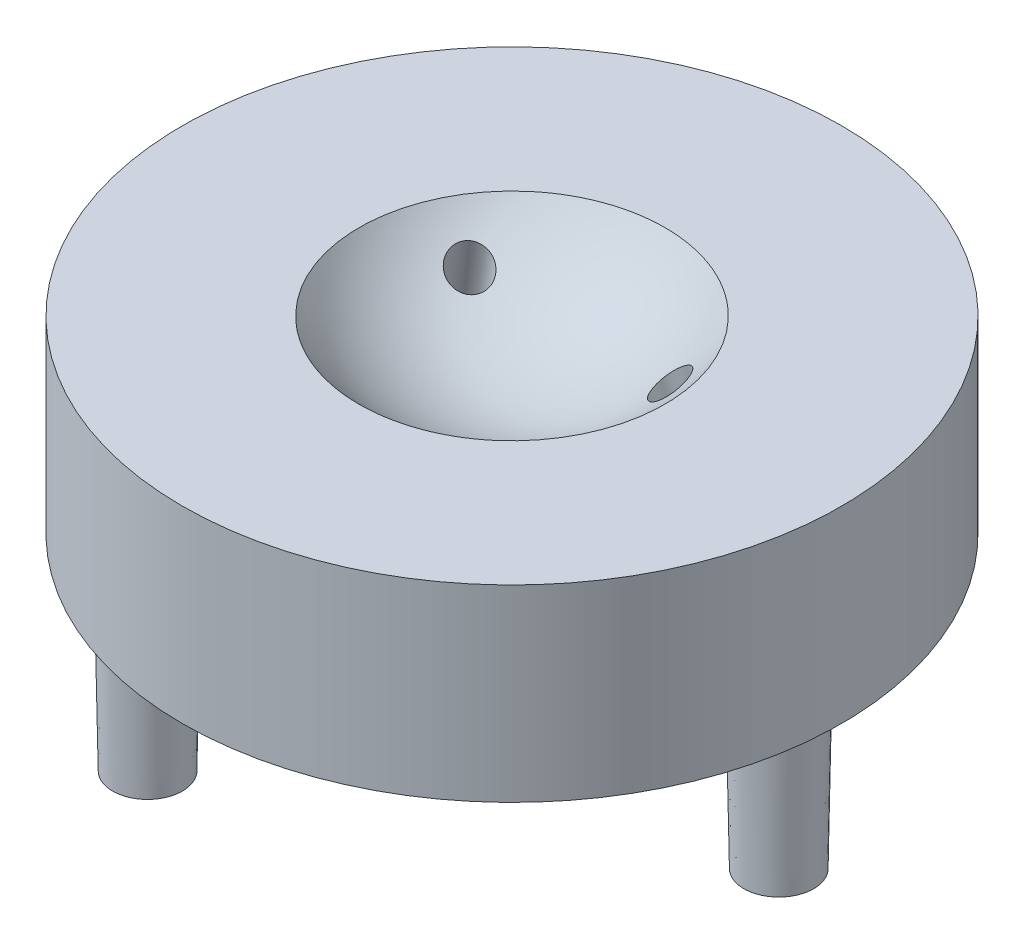
from build123d import *

# Parameters (mm, degrees)
EXTRUDE_1_DEPTH           = 6
SKETCH_6_OUTSIDE_W        = 112.61
SKETCH_6_OUTSIDE_H        = 112.61
SKETCH_6_OUTSIDE_R        = 10.5
CUT_EXTRUDE_2_DEPTH       = 10
SKETCH_7_R                = 1.2
EXTRUDE_3_DEPTH           = 5
EXTRUDE_3_DRAFT           = 1
EXTRUDE_3_PROFILE_2_DEPTH = 5
EXTRUDE_3_PROFILE_2_DRAFT = 1
EXTRUDE_3_PROFILE_3_DEPTH = 5
EXTRUDE_3_PROFILE_3_DRAFT = 1
SWEEP_1_PROFILE_R         = 0.6
PATTERN_CIRCULAR_1_COUNT  = 3


with BuildPart() as part:
    # 草图1 → 凸台-拉伸1 (new body)
    with BuildSketch(Plane(origin=(0, 0, 0), x_dir=(1, 0, 0), z_dir=(0, 1, 0))):
        with BuildLine():
            Line((-28.1, 43.1), (28.1, 43.1))
            ThreePointArc((28.1, 43.1), (38.706601718, 38.706601718), (43.1, 28.1))
            Line((43.1, 28.1), (43.1, -28.1))
            ThreePointArc((43.1, -28.1), (38.706601718, -38.706601718), (28.1, -43.1))
            Line((28.1, -43.1), (-28.1, -43.1))
            ThreePointArc((-28.1, -43.1), (-38.706601718, -38.706601718), (-43.1, -28.1))
            Line((-43.1, -28.1), (-43.1, 28.1))
            ThreePointArc((-43.1, 28.1), (-38.706601718, 38.706601718), (-28.1, 43.1))
        make_face()
    extrude(amount=EXTRUDE_1_DEPTH)

    # 草图6 outside → 切除-拉伸2 (cut)
    with BuildSketch(Plane(origin=(0, 6, 0), x_dir=(1, 0, 0), z_dir=(0, 1, 0))):
        Rectangle(SKETCH_6_OUTSIDE_W, SKETCH_6_OUTSIDE_H)
        with Locations(Location((0, 0, 0), (0, 0, 270))):
            Circle(SKETCH_6_OUTSIDE_R, mode=Mode.SUBTRACT)
    extrude(amount=-CUT_EXTRUDE_2_DEPTH, mode=Mode.SUBTRACT)


with BuildPart() as extrude_3_tool:
    # 草图7 → 凸台-拉伸3 (with draft: the straight prism first)
    with BuildSketch(Plane.XZ):
        with Locations((8.5, 0)):
            Circle(SKETCH_7_R)
    extrude(amount=EXTRUDE_3_DEPTH)
    # 凸台-拉伸3: the draft: its side faces are tilted about the plane it starts from
    extrude_3_sides = [extrude_3_tool.faces().sort_by_distance(p)[0] for p in [
        (7.3, -2.5, 0),
    ]]
    draft(extrude_3_sides, Plane.XZ, EXTRUDE_3_DRAFT)


with BuildPart() as part_1:
    add(part.part)

    # 凸台-拉伸3: add extrude_3_tool
    add(extrude_3_tool.part)


with BuildPart() as extrude_3_profile_2_tool:
    # 草图7 → 凸台-拉伸3 profile 2 (with draft: the straight prism first)
    with BuildSketch(Plane.XZ):
        with Locations((-4.25, -7.361215932)):
            Circle(SKETCH_7_R)
    extrude(amount=EXTRUDE_3_PROFILE_2_DEPTH)
    # 凸台-拉伸3 profile 2: the draft: its side faces are tilted about the plane it starts from
    extrude_3_profile_2_sides = [extrude_3_profile_2_tool.faces().sort_by_distance(p)[0] for p in [
        (-5.45, -2.5, -7.361215932),
    ]]
    draft(extrude_3_profile_2_sides, Plane.XZ, EXTRUDE_3_PROFILE_2_DRAFT)


with BuildPart() as part_2:
    add(part_1.part)

    # 凸台-拉伸3 profile 2: add extrude_3_profile_2_tool
    add(extrude_3_profile_2_tool.part)


with BuildPart() as extrude_3_profile_3_tool:
    # 草图7 → 凸台-拉伸3 profile 3 (with draft: the straight prism first)
    with BuildSketch(Plane.XZ):
        with Locations((-4.25, 7.361215932)):
            Circle(SKETCH_7_R)
    extrude(amount=EXTRUDE_3_PROFILE_3_DEPTH)
    # 凸台-拉伸3 profile 3: the draft: its side faces are tilted about the plane it starts from
    extrude_3_profile_3_sides = [extrude_3_profile_3_tool.faces().sort_by_distance(p)[0] for p in [
        (-5.45, -2.5, 7.361215932),
    ]]
    draft(extrude_3_profile_3_sides, Plane.XZ, EXTRUDE_3_PROFILE_3_DRAFT)


with BuildPart() as part_3:
    add(part_2.part)

    # 凸台-拉伸3 profile 3: add extrude_3_profile_3_tool
    add(extrude_3_profile_3_tool.part)

    # 草图8 → 切除-旋转1 (revolve, cut)
    with BuildSketch(Plane(origin=(0, 9.5, 0), x_dir=(1, 0, 0), z_dir=(0, 1, 0))):
        with BuildLine():
            Line((0, 6), (0, -6))
            ThreePointArc((0, -6), (-6, 0), (0, 6))
        make_face()
    revolve(axis=Axis((0, 9.5, -6), (0, 0, 1)), mode=Mode.SUBTRACT)

    # 切除-拉伸3 cone 1 section (through the dimple's axis) → 切除-拉伸3 (revolve, cut)
    with BuildSketch(Plane(origin=(0, 0, 0), x_dir=(0, 0, -1), z_dir=(1, 0, 0))):
        Polygon((0, 0), (6, 0), (0, 2.06596568), align=None)
    revolve(axis=Axis((0, 0, 0), (0, 1, 0)), mode=Mode.SUBTRACT)

    # 切除-扫描1: sweep along a path in 草图12
    with BuildLine(Plane(origin=(0, 0, 0), x_dir=(0, 0, -1), z_dir=(1, 0, 0))) as sweep_1_path:
        Line((-3.177240677, 6.426747641), (-5.652840705, -1.383969025))
    # 切除-扫描1 profile (on start of the path) → 切除-扫描1 (sweep, cut)
    with BuildSketch(Plane(origin=(0, 6.426747641, 3.177240677), x_dir=(0, -0.30213643640779364, -0.9532646924096158), z_dir=(0, -0.9532646924096158, 0.30213643640779364))):
        Circle(SWEEP_1_PROFILE_R)
    sweep_1 = sweep(path=sweep_1_path.line, mode=Mode.SUBTRACT)

    # 阵列(圆周)1: 切除-扫描1 ×3 about axis
    pattern_circular_1_axis = Axis((0, 6, 0), (0, 1, 0))
    for i in range(1, PATTERN_CIRCULAR_1_COUNT):
        add(sweep_1.rotate(pattern_circular_1_axis, i * 360 / PATTERN_CIRCULAR_1_COUNT), mode=Mode.SUBTRACT)


solid = part_3.part
